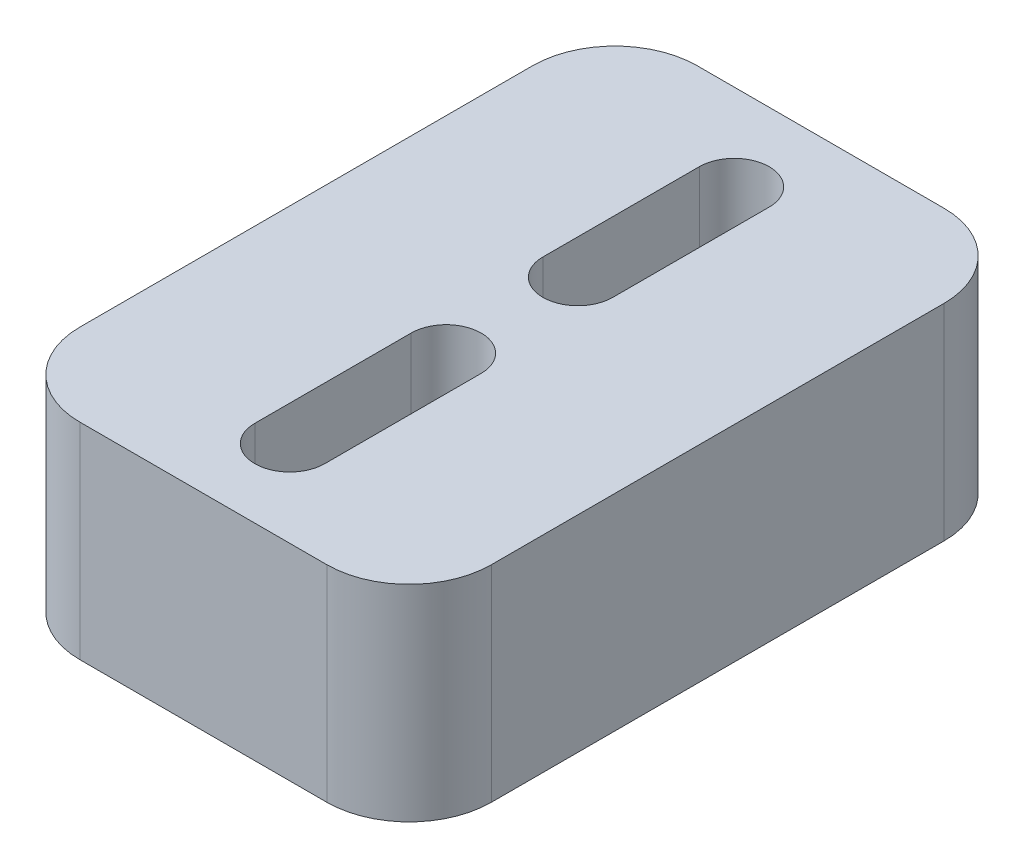
from build123d import *

# Parameters (mm, degrees)
SKETCH1_W           = 20
SKETCH1_H           = 30
BOSS_EXTRUDE1_DEPTH = 10
FILLET1_R           = 4


with BuildPart() as part:
    # Sketch1 → Boss-Extrude1 (new body)
    with BuildSketch(Plane(origin=(0, 0, 0), x_dir=(1, 0, 0), z_dir=(0, 1, 0))):
        Rectangle(SKETCH1_W, SKETCH1_H)
        with BuildLine():
            Line((1.7, 10.8), (1.7, 3.2))
            ThreePointArc((1.7, 3.2), (0, 1.5), (-1.7, 3.2))
            Line((-1.7, 3.2), (-1.7, 10.8))
            ThreePointArc((-1.7, 10.8), (0, 12.5), (1.7, 10.8))
        make_face(mode=Mode.SUBTRACT)
        with BuildLine():
            Line((1.7, -10.8), (1.7, -3.2))
            ThreePointArc((1.7, -3.2), (0, -1.5), (-1.7, -3.2))
            Line((-1.7, -3.2), (-1.7, -10.8))
            ThreePointArc((-1.7, -10.8), (0, -12.5), (1.7, -10.8))
        make_face(mode=Mode.SUBTRACT)
    extrude(amount=BOSS_EXTRUDE1_DEPTH)

    # Fillet1
    fillet1_edges = [part.edges().sort_by_distance(p)[0] for p in [
        (10, 5, 15),
        (-10, 5, 15),
        (-10, 5, -15),
        (10, 5, -15),
    ]]
    fillet(fillet1_edges, radius=FILLET1_R)


solid = part.part
